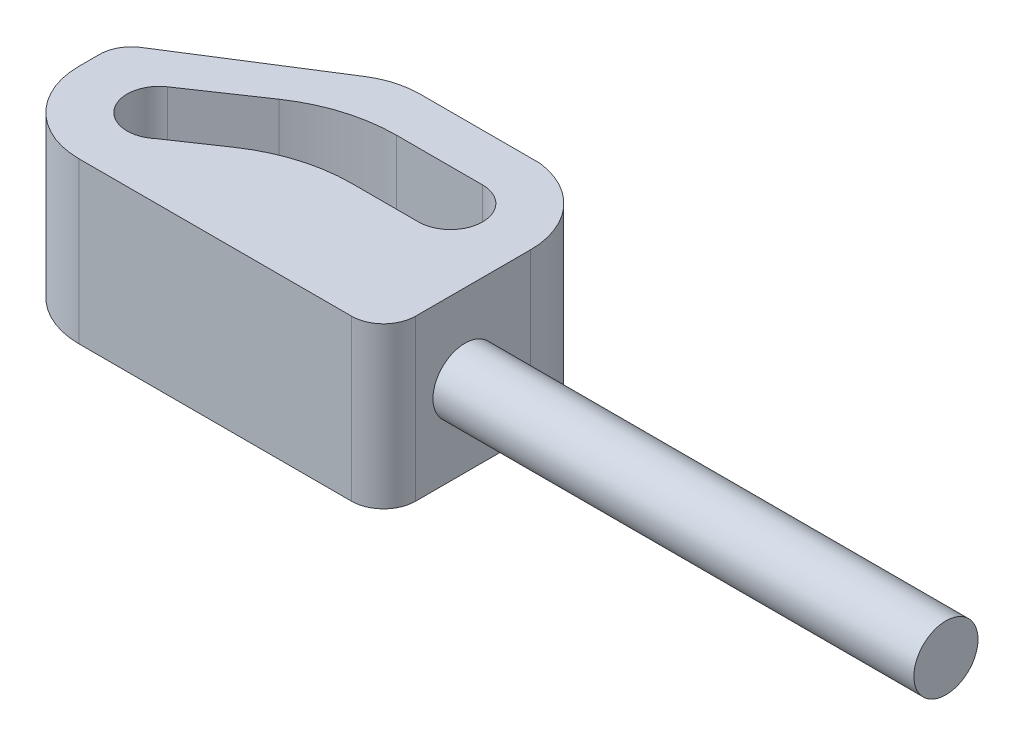
from build123d import *

# Parameters (mm, degrees)
BOSS_EXTRUDE1_DEPTH = 10
SKETCH2_R           = 2
BOSS_EXTRUDE2_DEPTH = 30


with BuildPart() as part:
    # Sketch1 → Boss-Extrude1 (new body)
    with BuildSketch(Plane(origin=(0, 0, 0), x_dir=(1, 0, 0), z_dir=(0, 1, 0))):
        with BuildLine():
            Line((-4.915670141, -9.915670141), (12.084329859, -9.915670141))
            ThreePointArc((12.084329859, -9.915670141), (13.498543421, -9.329883704), (14.084329859, -7.915670141))
            Line((14.084329859, -7.915670141), (14.084329859, -0.738316599))
            ThreePointArc((14.084329859, -0.738316599), (12.841308154, 2.560943028), (9.730284223, 4.219782125))
            Line((9.730284223, 4.219782125), (2.224360471, 4.219782125))
            ThreePointArc((2.224360471, 4.219782125), (0.833058018, 4.022310364), (-0.448347257, 3.445493118))
            Line((-0.448347257, 3.445493118), (-8.984753233, -1.953673617))
            ThreePointArc((-8.984753233, -1.953673617), (-9.667550015, -2.67911766), (-9.915670141, -3.643958014))
            Line((-9.915670141, -3.643958014), (-9.915670141, -4.915670141))
            ThreePointArc((-9.915670141, -4.915670141), (-8.451204047, -8.451204047), (-4.915670141, -9.915670141))
        make_face()
        with BuildLine():
            Line((-6.036927005, -3.259535169), (-1.898433993, -0.45764174))
            ThreePointArc((-1.898433993, -0.45764174), (0.775850036, 0.822194595), (3.707850327, 1.261683401))
            Line((3.707850327, 1.261683401), (9.084329859, 1.261683401))
            ThreePointArc((9.084329859, 1.261683401), (11.084329859, -0.738316599), (9.084329859, -2.738316599))
            Line((9.084329859, -2.738316599), (4.908888201, -2.738316599))
            ThreePointArc((4.908888201, -2.738316599), (1.976887911, -3.177805405), (-0.697396118, -4.45764174))
            Line((-0.697396118, -4.45764174), (-3.604145519, -6.425604963))
            ThreePointArc((-3.604145519, -6.425604963), (-6.501561039, -6.134255412), (-6.036927005, -3.259535169))
        make_face(mode=Mode.SUBTRACT)
    extrude(amount=BOSS_EXTRUDE1_DEPTH)

    # Sketch2 → Boss-Extrude2 (add)
    with BuildSketch(Plane(origin=(14.084329859, 0, 0), x_dir=(0, 0, -1), z_dir=(1, 0, 0))):
        with Locations(Location((-4.833857575, 5, 0), (0, 0, 180))):
            Circle(SKETCH2_R)
    extrude(amount=BOSS_EXTRUDE2_DEPTH)


solid = part.part
